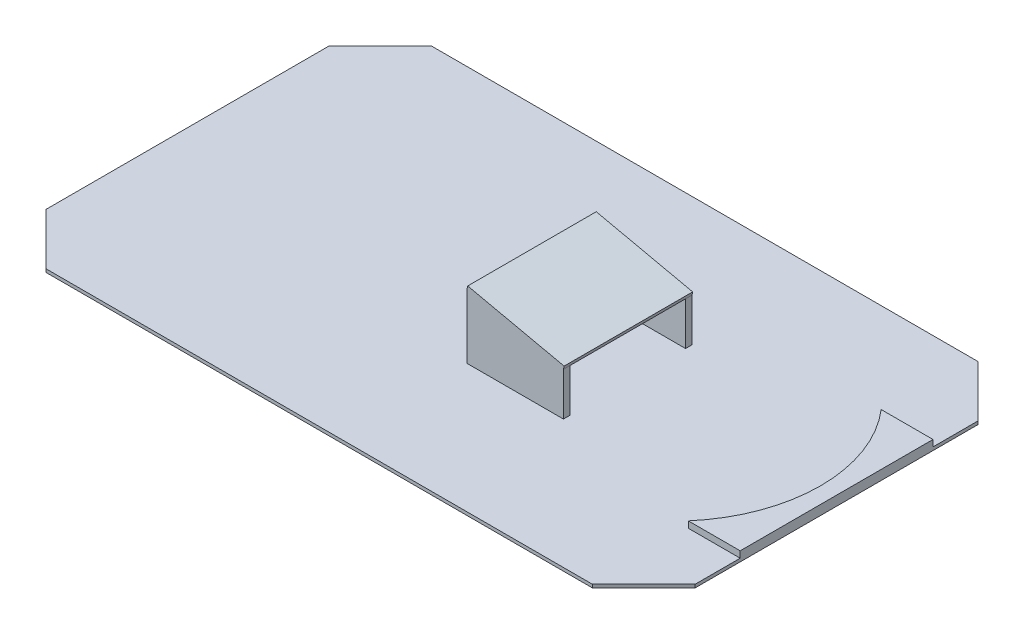
from build123d import *

# Parameters (mm, degrees)
EXTRUDE_1_DEPTH     = 5
EXTRUDE_5_DEPTH     = 30
EXTRUDE_6_DEPTH     = 30
CUT_EXTRUDE_1_DEPTH = 50
EXTRUDE_7_DEPTH     = 10
EXTRUDE_9_DEPTH     = 100
CUT_EXTRUDE_2_DEPTH = 653.725056973
SKETCH_15_W         = 153.587108834
SKETCH_15_H         = 200
EXTRUDE_11_DEPTH    = 5


with BuildPart() as part:
    # 草图1 → 凸台-拉伸1 (new body)
    with BuildSketch(Plane(origin=(0, 0, 0), x_dir=(1, 0, 0), z_dir=(0, 1, 0))):
        Polygon((-505, -50), (-505, 220), (-425, 300), (425, 300), (505, 220), (505, -10), (505, -220), (425, -300), (-425, -300), (-505, -220), align=None)
    extrude(amount=EXTRUDE_1_DEPTH)

    # 草图5 → 凸台-拉伸5 (add)
    with BuildSketch(Plane(origin=(0, 5, 0), x_dir=(1, 0, 0), z_dir=(0, 1, 0))):
        Polygon((90, 0), (90, -10), (110, -10), (110, 10), (90, 10), align=None)
    extrude(amount=EXTRUDE_5_DEPTH)

    # 草图6 → 凸台-拉伸6 (add)
    with BuildSketch(Plane(origin=(0, 35, 0), x_dir=(1, 0, 0), z_dir=(0, 1, 0))):
        Polygon((100, -25), (125, -25), (125, 25), (75, 25), (75, -25), align=None)
    extrude(amount=EXTRUDE_6_DEPTH)

    # 草图7 → 切除-拉伸1 (cut)
    with BuildSketch(Plane(origin=(125, 0, 0), x_dir=(0, 0, -1), z_dir=(1, 0, 0))):
        Polygon((0, 57.5), (-7.5, 57.5), (-7.5, 42.5), (7.5, 42.5), (7.5, 57.5), align=None)
    extrude(amount=-CUT_EXTRUDE_1_DEPTH, mode=Mode.SUBTRACT)

    # 草图8 → 凸台-拉伸7 (add)
    with BuildSketch(Plane(origin=(0, 5, 0), x_dir=(1, 0, 0), z_dir=(0, 1, 0))):
        with BuildLine():
            Line((505, 0), (505, 150))
            Line((505, 150), (424.355957742, 150))
            ThreePointArc((424.355957742, 150), (480, 0), (424.355957742, -150))
            Line((424.355957742, -150), (505, -150))
            Line((505, -150), (505, 0))
        make_face()
    extrude(amount=EXTRUDE_7_DEPTH)

    # 草图12 → 凸台-拉伸9 (add)
    with BuildSketch(Plane(origin=(0, 5, 0), x_dir=(1, 0, 0), z_dir=(0, 1, 0))):
        Polygon((30, -90), (100, -90), (180, -90), (180, -100), (100, -100), (30, -100), align=None)
        Polygon((100, 100), (30, 100), (30, 90), (100, 90), (180, 90), (180, 100), align=None)
    extrude(amount=EXTRUDE_9_DEPTH)

    # 草图13 → 切除-拉伸2 (cut, through all)
    with BuildSketch(Plane.XY.offset(100)):
        Polygon((180, 105), (180, 72), (30, 105), align=None)
    extrude(amount=-CUT_EXTRUDE_2_DEPTH, mode=Mode.SUBTRACT)

    # 草图15 → 凸台-拉伸11 (add)
    with BuildSketch(Plane(origin=(23.418542541, 106.447920641, 0), x_dir=(0.9766444667050901, -0.21486178267511977, 0), z_dir=(0.21486178267511977, 0.9766444667050901, 0))):
        with Locations((83.532401237, 0)):
            Rectangle(SKETCH_15_W, SKETCH_15_H)
    extrude(amount=EXTRUDE_11_DEPTH)


solid = part.part
